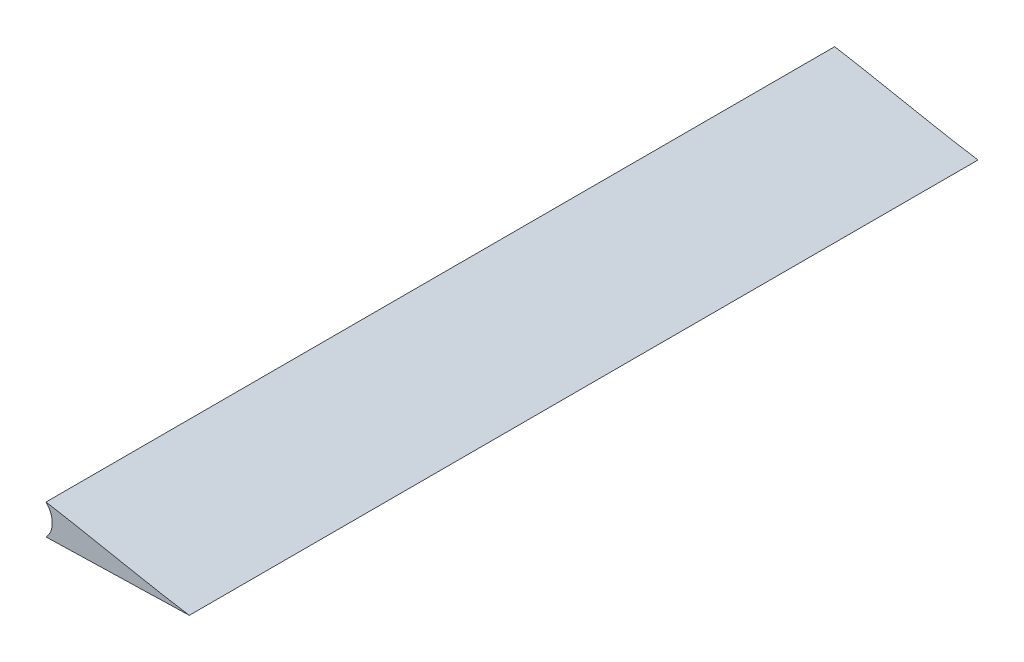
from build123d import *

# Parameters (mm, degrees)
BOSS_EXTRUDE1_DEPTH     = 875
CUT_EXTRUDE1_DEPTH      = 881.879454843
CUT_EXTRUDE1_DEPTH_BACK = 881.879454843
CUT_EXTRUDE2_DEPTH      = 328.226273651


with BuildPart() as part:
    # Sketch1 → Boss-Extrude1 (new, symmetric)
    with BuildSketch(Plane.XY):
        with BuildLine():
            add(Edge.make_bspline(
                [(100.91824287, -5.70312156), (100.917928302, -5.691984058), (100.103872555, -5.623522289), (99.280592479, -5.464574379), (97.301838761, -5.167293181), (94.893792204, -4.740313208), (91.763418033, -4.194020721), (88.075779131, -3.527092424), (83.82586832, -2.733839889), (79.07466539, -1.829159833), (73.868292655, -0.815261424), (68.257586758, 0.28149671), (62.297699244, 1.44772436), (56.040627516, 2.659541325), (49.522304418, 3.863298421), (42.776163339, 5.024182063), (35.842465214, 6.159362695), (28.754894986, 7.225237491), (21.557088168, 8.212036363), (14.289938921, 9.11702244), (6.986491581, 9.896502104), (-0.312291465, 10.567439736), (-7.573250933, 11.101452566), (-14.756788427, 11.484472196), (-21.829214216, 11.73432499), (-28.756354515, 11.821009192), (-35.503522333, 11.750617393), (-42.039927215, 11.528099679), (-48.337618053, 11.139668586), (-54.368823591, 10.599316119), (-60.107813763, 9.916065983), (-65.5246312, 9.082841334), (-70.600710971, 8.133580398), (-75.312124387, 7.06030936), (-79.639012678, 5.882400605), (-83.565794194, 4.620592947), (-87.074573399, 3.286478994), (-90.155255222, 1.908430123), (-92.7947781, 0.504611279), (-94.983077923, -0.904381491), (-96.712918902, -2.27019758), (-98.000485425, -3.580792759), (-98.761905736, -4.743195836), (-99.230109063, -5.858193724), (-98.606025292, -6.870082158), (-97.444377041, -7.545330585), (-95.746709082, -8.188615648), (-93.444858666, -8.65302005), (-90.532849186, -8.981809806), (-87.012786058, -9.249938029), (-82.906631066, -9.471230862), (-78.240220774, -9.591108348), (-73.047587861, -9.700035936), (-67.364458994, -9.726825212), (-61.232945666, -9.735598818), (-54.695580066, -9.663971329), (-47.787860167, -9.57405054), (-40.547660449, -9.399905225), (-33.014906842, -9.224168897), (-25.241541211, -9.024405524), (-17.28179212, -8.801970667), (-9.194124895, -8.575484575), (-1.034753503, -8.389600976), (7.134931724, -8.163914261), (15.261915306, -7.937211966), (23.292019947, -7.753265877), (31.171989128, -7.520412865), (38.853338861, -7.320323338), (46.282726984, -7.155039977), (53.396722649, -6.942825345), (60.134764376, -6.764425726), (66.461797873, -6.610760114), (72.370019545, -6.444067915), (77.851690837, -6.304693879), (82.870292529, -6.189451934), (87.37297449, -6.074184551), (91.286636897, -5.943657403), (94.610580102, -5.86381881), (97.158504539, -5.820700532), (99.231452991, -5.738256396), (100.085997803, -5.733999914), (100.918560502, -5.714367546), (100.91824287, -5.70312156)],
                knots=[0, 0, 0, 0, 0.000950607, 0.003756507, 0.008317118, 0.014521534, 0.022293258, 0.031559824, 0.042220752, 0.054150955, 0.067231026, 0.081331038, 0.096307423, 0.112011952, 0.128327294, 0.145184499, 0.162487629, 0.180135525, 0.198033488, 0.216058829, 0.234134495, 0.252191782, 0.270104077, 0.287817033, 0.305234681, 0.322284448, 0.338896329, 0.354986109, 0.370505848, 0.385416956, 0.399632136, 0.413115968, 0.42582253, 0.437703697, 0.448737409, 0.458879724, 0.468105333, 0.476404612, 0.483748471, 0.49013386, 0.495557186, 0.500011534, 0.503516098, 0.506001286, 0.508215361, 0.511493607, 0.515843652, 0.521547383, 0.528754592, 0.537448665, 0.547575188, 0.55907379, 0.571867409, 0.585873248, 0.600979911, 0.617080267, 0.634081341, 0.651920682, 0.670483603, 0.689642387, 0.709259499, 0.729200941, 0.749303287, 0.769441295, 0.789466278, 0.8092541, 0.828669736, 0.847597548, 0.865914743, 0.883466594, 0.900078509, 0.915617835, 0.930134998, 0.943663107, 0.956049855, 0.967158865, 0.976852657, 0.984995817, 0.991471781, 0.996183553, 0.999040133, 1, 1, 1, 1], degree=3))
        make_face()
    extrude(amount=BOSS_EXTRUDE1_DEPTH, both=True)

    # Sketch3 → Cut-Extrude1 (cut, two sides: drawn at the far end of the back side and taken through both)
    with BuildSketch(Plane(origin=(0, 0, 0), x_dir=(1, 0, 0), z_dir=(0, 1, 0)).offset(-CUT_EXTRUDE1_DEPTH_BACK)):
        Polygon((100.918243231, 835.9), (44.370126982, 835.9), (44.370126982, 524.707472239), (100.918243231, 524.707472239), (100.918243231, -524.707472239), (44.370126982, -524.707472239), (44.370126982, -835.9), (100.918243231, -835.9), (100.918243231, -1428.407127824), (-134.13320566, -1428.407127824), (-134.13320566, 941.271454546), (100.918243231, 941.271454546), align=None)
    extrude(amount=CUT_EXTRUDE1_DEPTH + CUT_EXTRUDE1_DEPTH_BACK, mode=Mode.SUBTRACT)


with BuildPart() as cut_extrude1_piece_1:
    # of the separate pieces the step leaves, piece 1, a body of its own (cut_extrude1_pieces)
    add(part.part.solids().sort_by_distance((100.91824311, -5.703138592, 524.707472239))[0])


with BuildPart() as cut_extrude1_piece_2:
    # of the separate pieces the step leaves, piece 2, a body of its own (cut_extrude1_pieces)
    add(part.part.solids().sort_by_distance((44.370126982, 4.745424617, -524.707472239))[0])

    # Sketch4 → Cut-Extrude2 (cut, through all)
    with BuildSketch(Plane.XY.offset(-524.707472239)):
        with BuildLine():
            Line((44.370126982, 4.745424614), (44.370126982, -7.193951111))
            ThreePointArc((44.370126982, -7.193951111), (46.842852658, -1.224263248), (44.370126982, 4.745424614))
        make_face()
    extrude(amount=-CUT_EXTRUDE2_DEPTH, mode=Mode.SUBTRACT)


solid = cut_extrude1_piece_2.part
